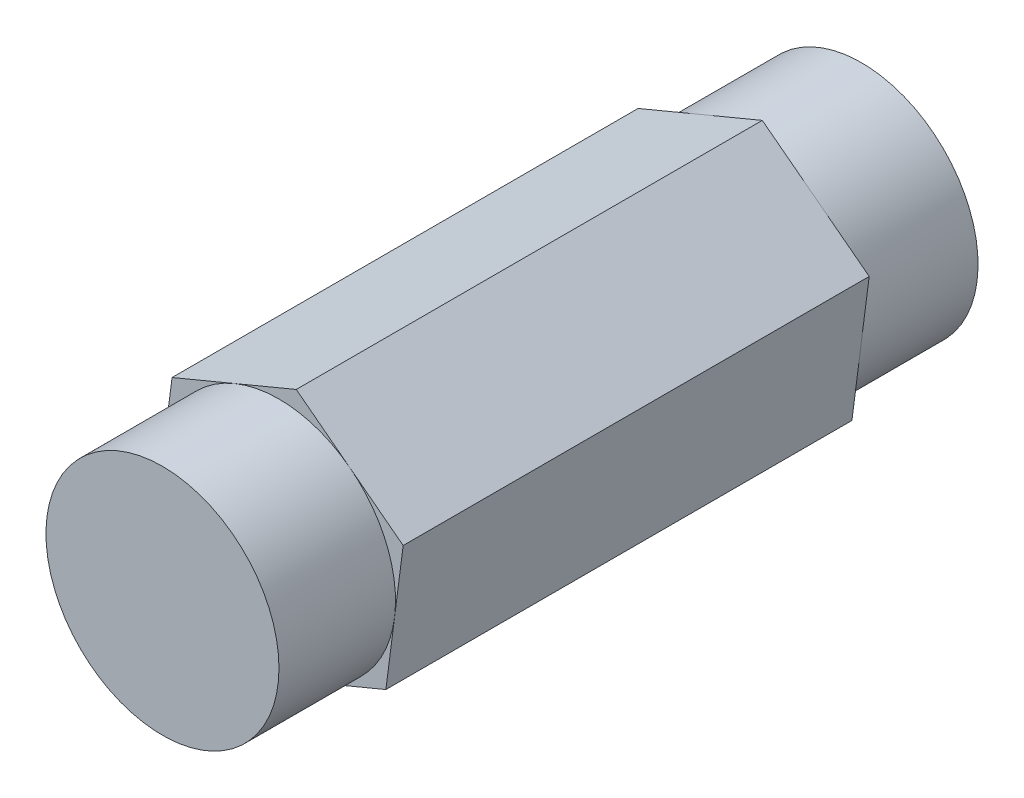
from build123d import *

# Parameters (mm, degrees)
EXTRUDE_2_DEPTH = 20
SKETCH_2_R      = 5
EXTRUDE_3_DEPTH = 5
EXTRUDE_START   = 5
SKETCH_3_R      = 5
EXTRUDE_4_DEPTH = 5


with BuildPart() as part:
    # 草图1 → 凸台-拉伸2 (new body)
    with BuildSketch(Plane.XY):
        Polygon((5.3293871, 2.220577958), (0.741616627, 5.725673595), (-4.587770473, 3.505095636), (-5.3293871, -2.220577958), (-0.741616627, -5.725673595), (4.587770473, -3.505095636), align=None)
    extrude(amount=EXTRUDE_2_DEPTH)

    # 草图2 → 凸台-拉伸3 (add)
    with BuildSketch(Plane(origin=(0, 0, 0), x_dir=(-1, 0, 0), z_dir=(0, 0, -1))):
        with Locations(Location((0, 0, 0), (0, 0, 187.380135052))):
            Circle(SKETCH_2_R)
    extrude(amount=EXTRUDE_3_DEPTH)

    # 草图3 → 凸台-拉伸4 (add)
    with BuildSketch(Plane.XY.offset(20).offset(EXTRUDE_START)):
        with Locations(Location((0, 0, 0), (0, 0, 352.619864948))):
            Circle(SKETCH_3_R)
    extrude(amount=-EXTRUDE_4_DEPTH)


solid = part.part
